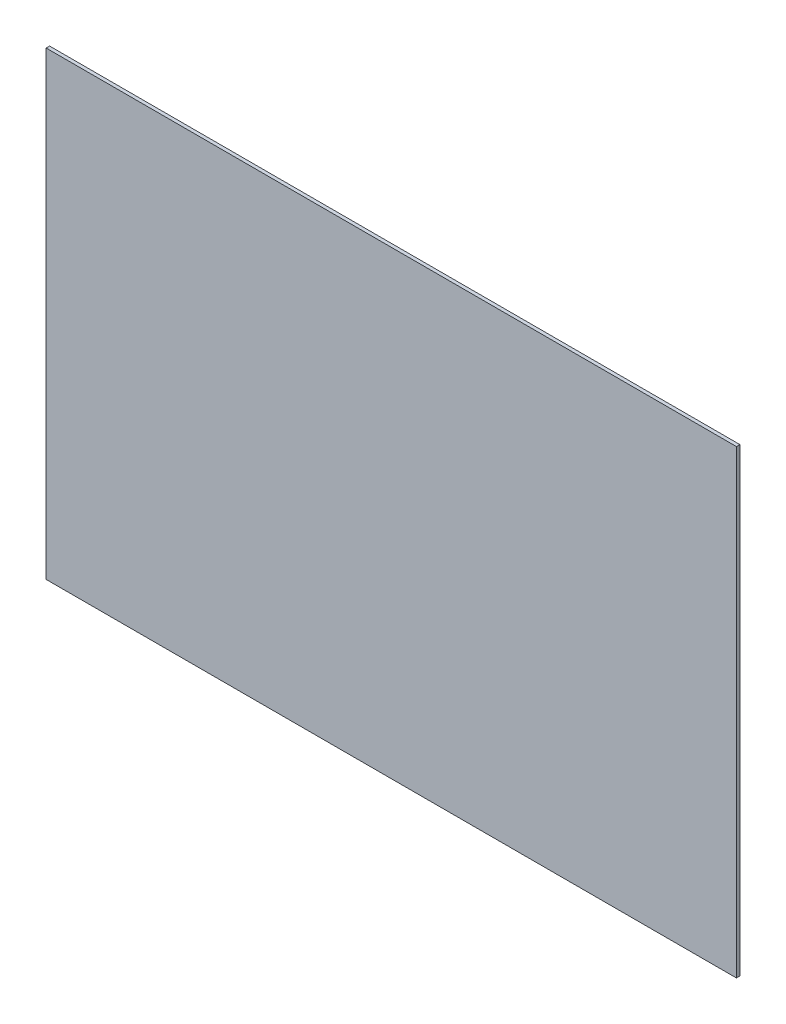
from build123d import *

# Parameters (mm, degrees)
SZKIC1_W                    = 600
SZKIC1_H                    = 400
DODANIE_WYCI_GNI_CIE1_DEPTH = 3


with BuildPart() as part:
    # Szkic1 → Dodanie-wyciągnięcie1 (new body)
    with BuildSketch(Plane.XY):
        with Locations((-179.221062811, -76.76056338)):
            Rectangle(SZKIC1_W, SZKIC1_H)
    extrude(amount=DODANIE_WYCI_GNI_CIE1_DEPTH)


solid = part.part
